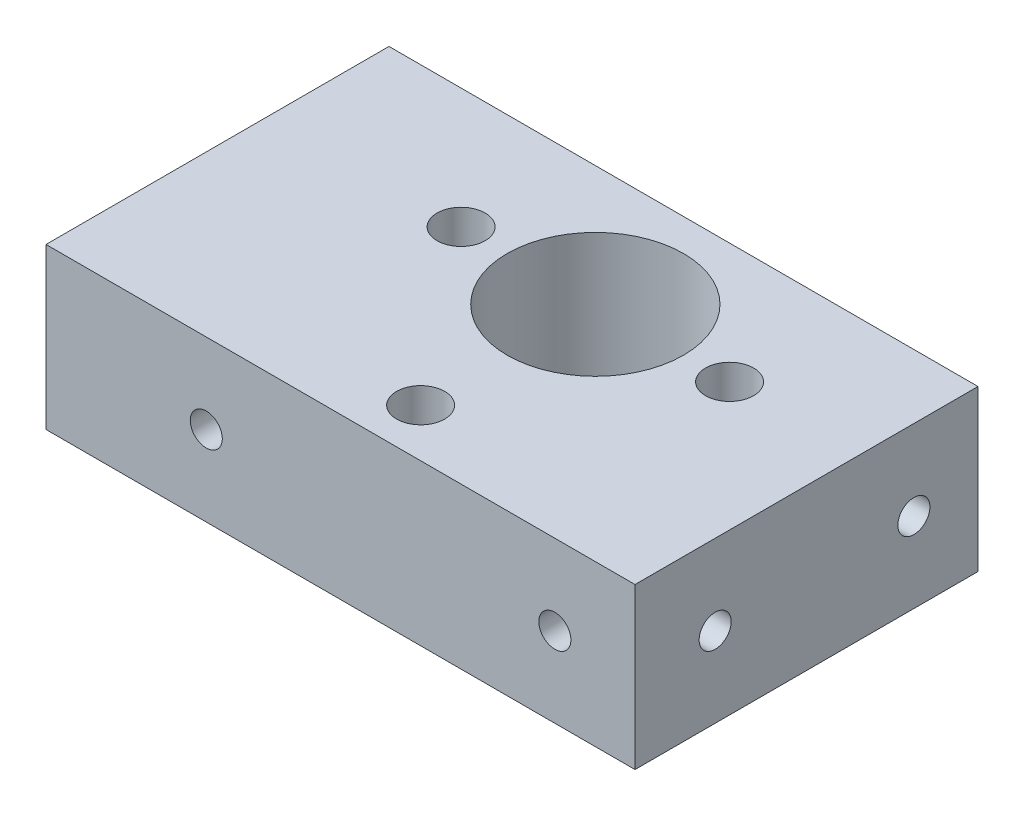
from build123d import *

# Parameters (mm, degrees)
SKETCH_1_W          = 36.75
SKETCH_1_H          = 21.4
SKETCH_1_R          = 1.5
EXTRUDE_1_DEPTH     = 10
SKETCH_1_16_R       = 2.25
CUT_EXTRUDE_1_DEPTH = 7
SKETCH_2_R          = 1
CUT_EXTRUDE_2_DEPTH = 2
CUT_EXTRUDE_START   = -19.4
SKETCH_2_2_R        = 1
CUT_EXTRUDE_3_DEPTH = 2
SKETCH_3_R          = 1
CUT_EXTRUDE_4_DEPTH = 4


with BuildPart() as part:
    # 草图1 → 凸台-拉伸1 (new body)
    with BuildSketch(Plane(origin=(0, 0, 0), x_dir=(1, 0, 0), z_dir=(0, 1, 0))):
        with Locations((-2, -3.2)):
            Rectangle(SKETCH_1_W, SKETCH_1_H)
        with Locations(Location((-8.375, 0, 0), (0, 0, 270))):
            Circle(SKETCH_1_R, mode=Mode.SUBTRACT)
        with BuildLine():
            ThreePointArc((5.5, 0), (0, -5.5), (-5.5, 0))
            ThreePointArc((-5.5, 0), (0, 5.5), (5.5, 0))
        make_face(mode=Mode.SUBTRACT)
        with Locations(Location((8.375, 0, 0), (0, 0, 270))):
            Circle(SKETCH_1_R, mode=Mode.SUBTRACT)
        with Locations(Location((0, -10.9, 0), (0, 0, 270))):
            Circle(SKETCH_1_R, mode=Mode.SUBTRACT)
    extrude(amount=EXTRUDE_1_DEPTH)

    # 草图1<16> → 切除-拉伸1 (cut)
    with BuildSketch(Plane(origin=(0, 0, 0), x_dir=(1, 0, 0), z_dir=(0, 1, 0))):
        with Locations(Location((-8.375, 0, 0), (0, 0, 270))):
            Circle(SKETCH_1_16_R)
        with Locations(Location((8.375, 0, 0), (0, 0, 270))):
            Circle(SKETCH_1_16_R)
        with Locations(Location((0, -10.9, 0), (0, 0, 270))):
            Circle(SKETCH_1_16_R)
    extrude(amount=CUT_EXTRUDE_1_DEPTH, mode=Mode.SUBTRACT)

    # 草图2 → 切除-拉伸2 (cut)
    with BuildSketch(Plane(origin=(0, 0, -7.5), x_dir=(-1, 0, 0), z_dir=(0, 0, -1))):
        with Locations((-11.375, 5)):
            Circle(SKETCH_2_R)
        with Locations((10.375, 5)):
            Circle(SKETCH_2_R)
    extrude(amount=-CUT_EXTRUDE_2_DEPTH, mode=Mode.SUBTRACT)

    # 草图2<2> → 切除-拉伸3 (cut)
    with BuildSketch(Plane(origin=(0, 0, -7.5), x_dir=(-1, 0, 0), z_dir=(0, 0, -1)).offset(CUT_EXTRUDE_START)):
        with Locations((-11.375, 5)):
            Circle(SKETCH_2_2_R)
        with Locations((10.375, 5)):
            Circle(SKETCH_2_2_R)
    extrude(amount=-CUT_EXTRUDE_3_DEPTH, mode=Mode.SUBTRACT)

    # 草图3 → 切除-拉伸4 (cut)
    with BuildSketch(Plane(origin=(16.375, 0, 0), x_dir=(0, 0, -1), z_dir=(1, 0, 0))):
        with Locations((-8.9, 5)):
            Circle(SKETCH_3_R)
        with Locations((3.5, 5)):
            Circle(SKETCH_3_R)
    extrude(amount=-CUT_EXTRUDE_4_DEPTH, mode=Mode.SUBTRACT)


solid = part.part
